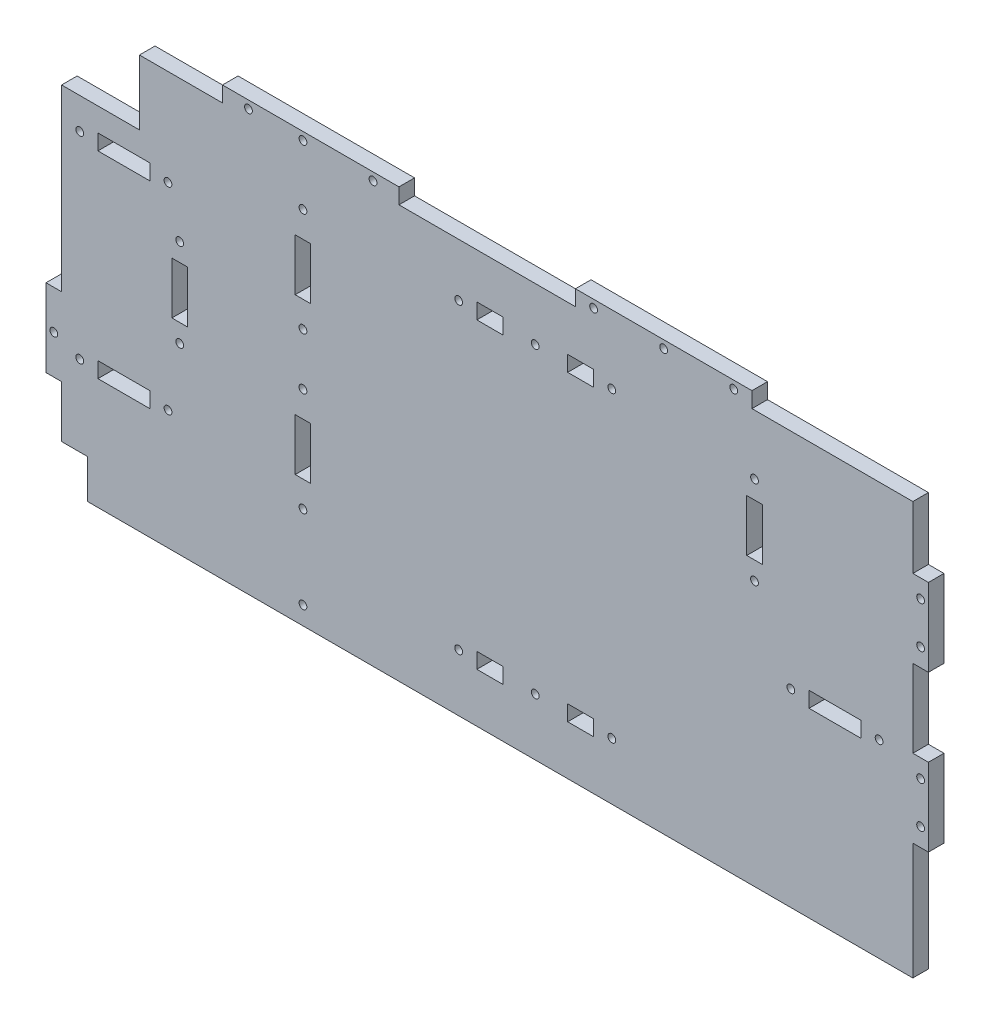
from build123d import *

# Parameters (mm, degrees)
ESQUISSE1_W             = 340
ESQUISSE1_H             = 165
BOSS_EXTRU_1_DEPTH      = 6
ESQUISSE2_W             = 6
ESQUISSE2_H             = 20
ESQUISSE2_W_2           = 68
ESQUISSE2_H_2           = 6
ESQUISSE2_H_3           = 45
ESQUISSE2_H_4           = 35
ESQUISSE2_H_5           = 30
ESQUISSE2_W_3           = 20
ENL_V_MAT_EXTRU_1_DEPTH = 6
ESQUISSE3_W             = 6
ESQUISSE3_H             = 20
ESQUISSE3_W_2           = 20
ESQUISSE3_H_2           = 6
ESQUISSE3_W_3           = 30
ESQUISSE3_H_3           = 25
ENL_V_MAT_EXTRU_2_DEPTH = 10
ESQUISSE5_R             = 1.5
ESQUISSE5_W             = 10
ESQUISSE5_H             = 6
ENL_V_MAT_EXTRU_4_DEPTH = 6
ESQUISSE7_R             = 1.5
ESQUISSE7_R_2           = 1.505
ESQUISSE7_W             = 10
ESQUISSE7_H             = 15
ENL_V_MAT_EXTRU_7_DEPTH = 378.969575495
ESQUISSE8_R             = 2.995
ESQUISSE8_R_2           = 3
ENL_V_MAT_EXTRU_9_DEPTH = 3


with BuildPart() as part:
    # Esquisse1 → Boss.-Extru.1 (new body)
    with BuildSketch(Plane.XY):
        with Locations((-170, 82.5)):
            Rectangle(ESQUISSE1_W, ESQUISSE1_H)
    extrude(amount=BOSS_EXTRU_1_DEPTH)

    # Esquisse2 → Enlèv. mat.-Extru.1 (cut)
    with BuildSketch(Plane.XY.offset(6)):
        Polygon((0, 165), (0, 135), (-6, 135), (-6, 159), (-68, 159), (-68, 165), align=None)
        Polygon((-340, 165), (-272, 165), (-272, 159), (-334, 159), (-334, 65), (-340, 65), align=None)
        with Locations((-67, 119)):
            Rectangle(ESQUISSE2_W, ESQUISSE2_H)
        with Locations((-170, 162)):
            Rectangle(ESQUISSE2_W_2, ESQUISSE2_H_2)
        with Locations((-3, 22.5)):
            Rectangle(ESQUISSE2_W, ESQUISSE2_H_3)
        with Locations((-337, 17.5)):
            Rectangle(ESQUISSE2_W, ESQUISSE2_H_4)
        with Locations((-3, 90)):
            Rectangle(ESQUISSE2_W, ESQUISSE2_H_5)
        with Locations((-36, 73)):
            Rectangle(ESQUISSE2_W_3, ESQUISSE2_H_2)
    extrude(amount=-ENL_V_MAT_EXTRU_1_DEPTH, mode=Mode.SUBTRACT)

    # Esquisse3 → Enlèv. mat.-Extru.2 (cut)
    with BuildSketch(Plane(origin=(0, 0, 0), x_dir=(-1, 0, 0), z_dir=(0, 0, -1))):
        with Locations((241, 119)):
            Rectangle(ESQUISSE3_W, ESQUISSE3_H)
        with Locations((241, 59)):
            Rectangle(ESQUISSE3_W, ESQUISSE3_H)
        with Locations((288.5, 87.5)):
            Rectangle(ESQUISSE3_W, ESQUISSE3_H)
        with Locations((310, 46)):
            Rectangle(ESQUISSE3_W_2, ESQUISSE3_H_2)
        with Locations((310, 122)):
            Rectangle(ESQUISSE3_W_2, ESQUISSE3_H_2)
        with Locations((319, 146.5)):
            Rectangle(ESQUISSE3_W_3, ESQUISSE3_H_3)
    extrude(amount=-ENL_V_MAT_EXTRU_2_DEPTH, mode=Mode.SUBTRACT)

    # Esquisse5 → Enlèv. mat.-Extru.4 (cut)
    with BuildSketch(Plane(origin=(0, 0, 0), x_dir=(-1, 0, 0), z_dir=(0, 0, -1))):
        with Locations((151.5, 138.6)):
            Circle(ESQUISSE5_R)
        with Locations((151.5, 22)):
            Circle(ESQUISSE5_R)
        with Locations((134, 138.6)):
            Rectangle(ESQUISSE5_W, ESQUISSE5_H)
        with Locations((169, 138.6)):
            Rectangle(ESQUISSE5_W, ESQUISSE5_H)
        with Locations((134, 22)):
            Rectangle(ESQUISSE5_W, ESQUISSE5_H)
        with Locations((169, 22)):
            Rectangle(ESQUISSE5_W, ESQUISSE5_H)
    extrude(amount=-ENL_V_MAT_EXTRU_4_DEPTH, mode=Mode.SUBTRACT)

    # Esquisse7 → Enlèv. mat.-Extru.7 (cut, through all)
    with BuildSketch(Plane(origin=(0, 0, 0), x_dir=(-1, 0, 0), z_dir=(0, 0, -1))):
        with Locations((337, 50)):
            Circle(ESQUISSE7_R)
        with Locations((293, 122)):
            Circle(ESQUISSE7_R)
        with Locations((327, 122)):
            Circle(ESQUISSE7_R)
        with Locations((293, 46)):
            Circle(ESQUISSE7_R)
        with Locations((327, 46)):
            Circle(ESQUISSE7_R)
        with Locations((288.5, 70.5)):
            Circle(ESQUISSE7_R)
        with Locations((288.5, 104.5)):
            Circle(ESQUISSE7_R)
        with Locations((241, 39)):
            Circle(ESQUISSE7_R)
        with Locations((241, 79)):
            Circle(ESQUISSE7_R)
        with Locations((241, 99)):
            Circle(ESQUISSE7_R)
        with Locations((241, 139)):
            Circle(ESQUISSE7_R)
        with Locations((241, 7)):
            Circle(ESQUISSE7_R)
        with Locations((241, 162)):
            Circle(ESQUISSE7_R)
        with Locations((262, 162)):
            Circle(ESQUISSE7_R)
        with Locations((214, 162)):
            Circle(ESQUISSE7_R)
        with Locations((75, 162)):
            Circle(ESQUISSE7_R)
        with Locations((102, 162)):
            Circle(ESQUISSE7_R)
        with Locations((129, 162)):
            Circle(ESQUISSE7_R)
        with Locations((67, 102)):
            Circle(ESQUISSE7_R)
        with Locations((67, 136)):
            Circle(ESQUISSE7_R)
        with Locations((53, 73)):
            Circle(ESQUISSE7_R)
        with Locations((19, 73)):
            Circle(ESQUISSE7_R)
        with Locations((3, 52)):
            Circle(ESQUISSE7_R_2)
        with Locations((3, 68)):
            Circle(ESQUISSE7_R)
        with Locations((3, 112)):
            Circle(ESQUISSE7_R)
        with Locations((3, 128)):
            Circle(ESQUISSE7_R)
        with Locations((122, 138.6)):
            Circle(ESQUISSE7_R)
        with Locations((181, 138.6)):
            Circle(ESQUISSE7_R)
        with Locations((181, 22)):
            Circle(ESQUISSE7_R)
        with Locations((122, 22)):
            Circle(ESQUISSE7_R)
        with Locations((329, 7.5)):
            Rectangle(ESQUISSE7_W, ESQUISSE7_H)
    extrude(amount=-ENL_V_MAT_EXTRU_7_DEPTH, mode=Mode.SUBTRACT)

    # Esquisse8 → Enlèv. mat.-Extru.9 (cut)
    with BuildSketch(Plane(origin=(0, 0, 0), x_dir=(-1, 0, 0), z_dir=(0, 0, -1))):
        with Locations((3, 52)):
            Circle(ESQUISSE8_R)
        with Locations((3, 68)):
            Circle(ESQUISSE8_R)
        with Locations((19, 73)):
            Circle(ESQUISSE8_R_2)
        with Locations((3, 112)):
            Circle(ESQUISSE8_R)
        with Locations((3, 128)):
            Circle(ESQUISSE8_R)
        with Locations((53, 73)):
            Circle(ESQUISSE8_R_2)
        with Locations((67, 102)):
            Circle(ESQUISSE8_R_2)
        with Locations((67, 136)):
            Circle(ESQUISSE8_R_2)
        with Locations((75, 162)):
            Circle(ESQUISSE8_R)
        with Locations((102, 162)):
            Circle(ESQUISSE8_R)
        with Locations((129, 162)):
            Circle(ESQUISSE8_R)
        with Locations((122, 138.6)):
            Circle(ESQUISSE8_R_2)
        with Locations((151.5, 138.6)):
            Circle(ESQUISSE8_R_2)
        with Locations((181, 138.6)):
            Circle(ESQUISSE8_R_2)
        with Locations((181, 22)):
            Circle(ESQUISSE8_R_2)
        with Locations((151.5, 22)):
            Circle(ESQUISSE8_R_2)
        with Locations((122, 22)):
            Circle(ESQUISSE8_R_2)
        with Locations((214, 162)):
            Circle(ESQUISSE8_R)
        with Locations((241, 162)):
            Circle(ESQUISSE8_R)
        with Locations((262, 162)):
            Circle(ESQUISSE8_R)
        with Locations((241, 139)):
            Circle(ESQUISSE8_R_2)
        with Locations((241, 99)):
            Circle(ESQUISSE8_R_2)
        with Locations((241, 79)):
            Circle(ESQUISSE8_R_2)
        with Locations((241, 39)):
            Circle(ESQUISSE8_R_2)
        with Locations((241, 7)):
            Circle(ESQUISSE8_R_2)
        with Locations((337, 50)):
            Circle(ESQUISSE8_R)
        with Locations((327, 46)):
            Circle(ESQUISSE8_R_2)
        with Locations((293, 46)):
            Circle(ESQUISSE8_R_2)
        with Locations((288.5, 70.5)):
            Circle(ESQUISSE8_R_2)
        with Locations((288.5, 104.5)):
            Circle(ESQUISSE8_R_2)
        with Locations((293, 122)):
            Circle(ESQUISSE8_R_2)
        with Locations((327, 122)):
            Circle(ESQUISSE8_R_2)
    extrude(amount=-ENL_V_MAT_EXTRU_9_DEPTH, mode=Mode.SUBTRACT)


solid = part.part
